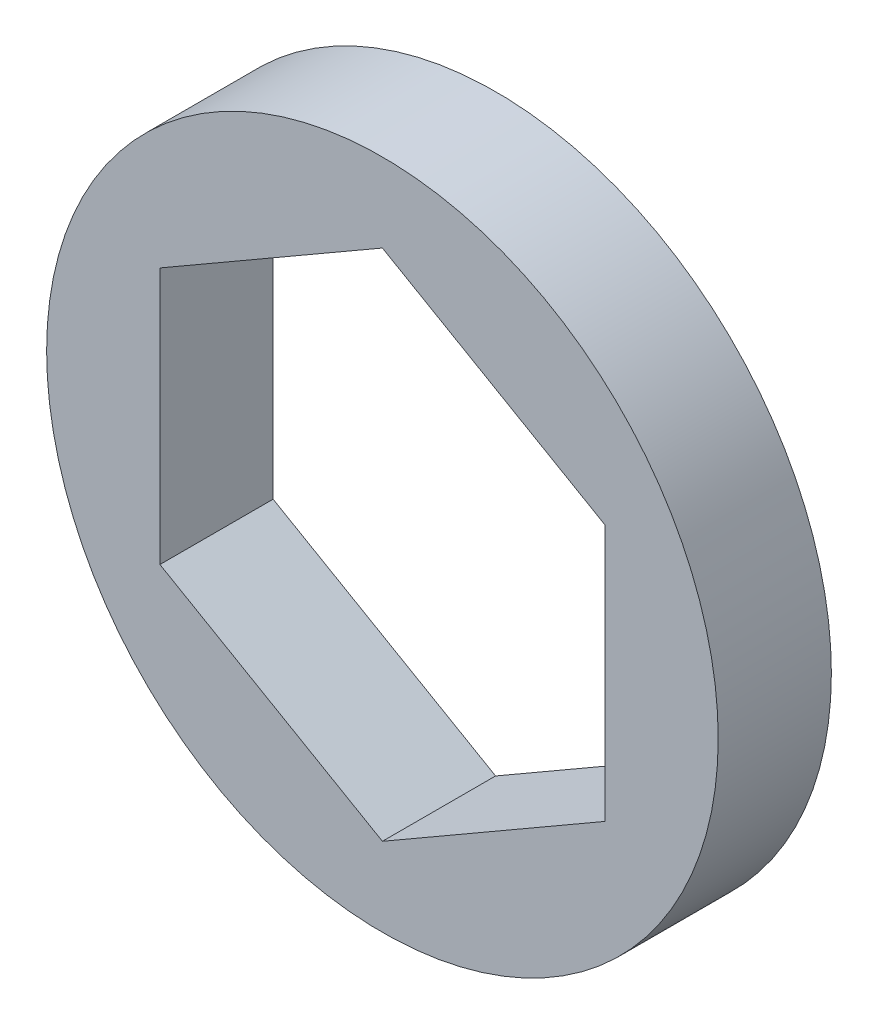
from build123d import *

# Parameters (mm, degrees)
SKETCH1_R           = 10.16
BOSS_EXTRUDE1_DEPTH = 3.42392


with BuildPart() as part:
    # Sketch1 → Boss-Extrude1 (new body)
    with BuildSketch(Plane.XY):
        Circle(SKETCH1_R)
        Polygon((6.731, 3.886144662), (0, 7.772289324), (-6.731, 3.886144662), (-6.731, -3.886144662), (0, -7.772289324), (6.731, -3.886144662), align=None, mode=Mode.SUBTRACT)
    extrude(amount=BOSS_EXTRUDE1_DEPTH)


solid = part.part
